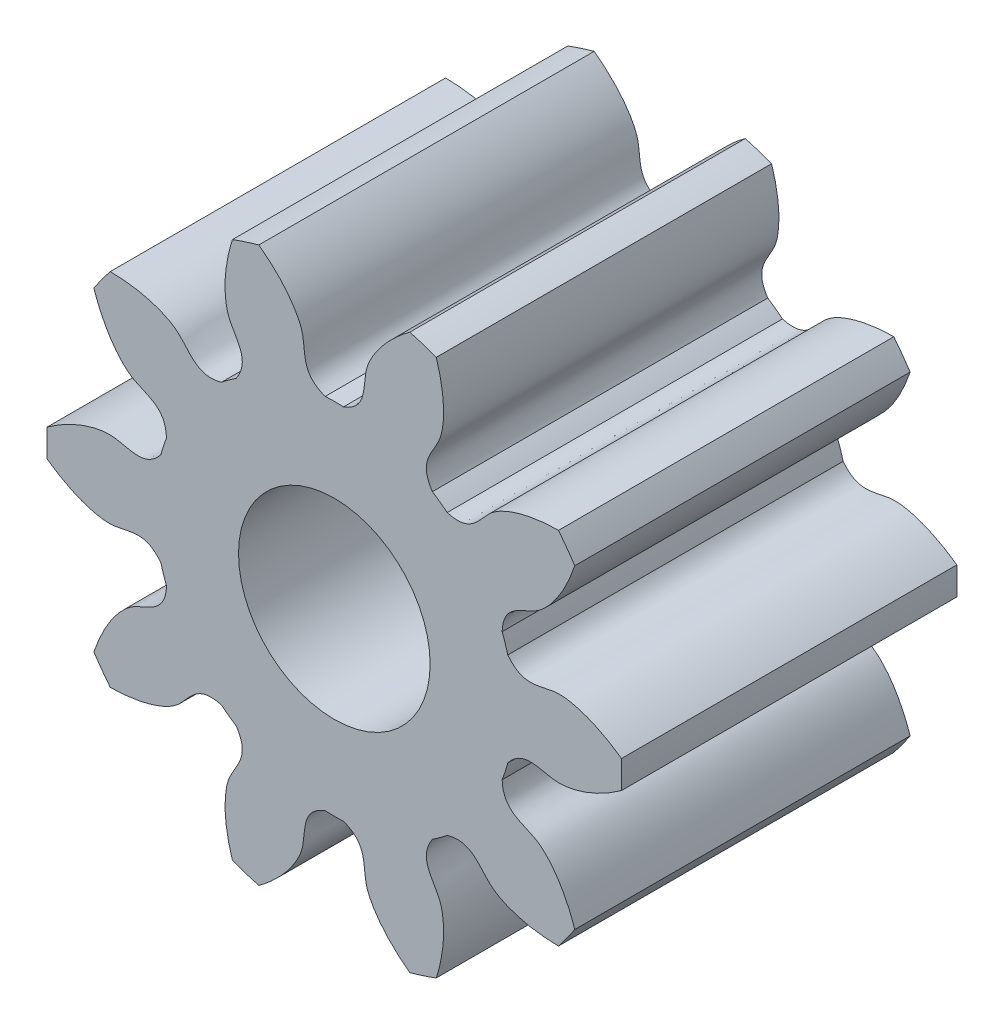
from build123d import *

# Parameters (mm, degrees)
SKETCH_1_R               = 3
EXTRUDE_1_DEPTH          = 3.5
CUT_EXTRUDE_1_DEPTH      = 6.5
PATTERN_CIRCULAR_1_COUNT = 10
SKETCH_4_R               = 1
CUT_EXTRUDE_2_DEPTH      = 6.443239799


with BuildPart() as part:
    # 草图1 → 凸台-拉伸1 (new body)
    with BuildSketch(Plane.XY):
        Circle(SKETCH_1_R)
    extrude(amount=EXTRUDE_1_DEPTH)

    # 草图2 → 切除-拉伸1 (cut, through all)
    with BuildSketch(Plane.XY):
        with BuildLine():
            ThreePointArc((0.095229133, 1.872580148), (0, 1.875), (-0.095229133, 1.872580148))
            add(Edge.make_bspline(
                [(-0.095229133, 1.872580148), (-0.362715165, 1.970284093), (-0.286920777, 2.185294723), (-0.344330803, 2.362336277), (-0.347251515, 2.37077245), (-0.350665635, 2.380030264), (-0.35460634, 2.390093167), (-0.359107284, 2.400943399), (-0.364201322, 2.412562246), (-0.369920867, 2.424929978), (-0.376297744, 2.438025881), (-0.383363205, 2.451828275), (-0.391147884, 2.466314521), (-0.399681784, 2.481461042), (-0.408994243, 2.497243338), (-0.419113912, 2.513636003), (-0.430068732, 2.530612743), (-0.441885908, 2.548146397), (-0.454591887, 2.566208951), (-0.468212335, 2.58477156), (-0.482772111, 2.603804571), (-0.498295251, 2.623277538), (-0.514804941, 2.64315925), (-0.532323498, 2.663417745), (-0.550872351, 2.68402034), (-0.570472019, 2.704933651), (-0.591142092, 2.726123613), (-0.612901212, 2.747555509), (-0.635767055, 2.769193992), (-0.659756316, 2.79100311), (-0.684884687, 2.812946332), (-0.711166843, 2.834986573), (-0.73861643, 2.857086218), (-0.767246042, 2.879207155), (-0.797067213, 2.901310796), (-0.828090401, 2.923358104), (-0.860324974, 2.945309627), (-0.8937792, 2.967125519), (-0.928460232, 2.988765572), (-0.964374099, 3.010189244), (-1.001525696, 3.031355689), (-1.039918773, 3.052223783), (-1.079555927, 3.072752157), (-1.120438592, 3.092899225), (-1.162567035, 3.112623216), (-1.205940346, 3.131882201), (-1.250556433, 3.150634125), (-1.296412017, 3.168836838), (-1.343502628, 3.186448125), (-1.3918226, 3.203425737), (-1.441365068, 3.219727424), (-1.492121969, 3.235310961), (-1.544084033, 3.250134185), (-1.597240793, 3.264155023), (-1.651580574, 3.277331523), (-1.707090504, 3.289621887), (-1.763756505, 3.300984501), (-1.821563307, 3.311377967), (-1.880494441, 3.320761135), (-1.940532246, 3.329093134), (-2.022655253, 3.338820511), (-2.084917451, 3.344293469), (-2.126793313, 3.34714445)],
                knots=[0, 0, 0, 0, 0.201720712, 0.204696754, 0.208022917, 0.211699204, 0.215725612, 0.220102144, 0.224828797, 0.229905574, 0.235332472, 0.241109493, 0.247236637, 0.253713903, 0.260541292, 0.267718803, 0.275246437, 0.283124193, 0.291352071, 0.299930073, 0.308858196, 0.318136442, 0.327764811, 0.337743302, 0.348071916, 0.358750652, 0.36977951, 0.381158491, 0.392887595, 0.404966821, 0.41739617, 0.430175641, 0.443305234, 0.45678495, 0.470614789, 0.48479475, 0.499324833, 0.514205039, 0.529435368, 0.545015819, 0.560946392, 0.577227088, 0.593857907, 0.610838848, 0.628169911, 0.645851097, 0.663882406, 0.682263837, 0.70099539, 0.720077066, 0.739508864, 0.759290785, 0.779422829, 0.799904995, 0.820737283, 0.841919694, 0.863452227, 0.885334883, 0.907567662, 0.930150562, 0.953083586, 1, 1, 1, 1], degree=3))
            ThreePointArc((-2.126793313, 3.34714445), (0, 3.965680996), (2.126793313, 3.34714445))
            add(Edge.make_bspline(
                [(0.095229133, 1.872580148), (0.362715165, 1.970284093), (0.286920777, 2.185294723), (0.344330803, 2.362336277), (0.347251515, 2.37077245), (0.350665635, 2.380030264), (0.35460634, 2.390093167), (0.359107284, 2.400943399), (0.364201322, 2.412562246), (0.369920867, 2.424929978), (0.376297744, 2.438025881), (0.383363205, 2.451828275), (0.391147884, 2.466314521), (0.399681784, 2.481461042), (0.408994243, 2.497243338), (0.419113912, 2.513636003), (0.430068732, 2.530612743), (0.441885908, 2.548146397), (0.454591887, 2.566208951), (0.468212335, 2.58477156), (0.482772111, 2.603804571), (0.498295251, 2.623277538), (0.514804941, 2.64315925), (0.532323498, 2.663417745), (0.550872351, 2.68402034), (0.570472019, 2.704933651), (0.591142092, 2.726123613), (0.612901212, 2.747555509), (0.635767055, 2.769193992), (0.659756316, 2.79100311), (0.684884687, 2.812946332), (0.711166843, 2.834986573), (0.73861643, 2.857086218), (0.767246042, 2.879207155), (0.797067213, 2.901310796), (0.828090401, 2.923358104), (0.860324974, 2.945309627), (0.8937792, 2.967125519), (0.928460232, 2.988765572), (0.964374099, 3.010189244), (1.001525696, 3.031355689), (1.039918773, 3.052223783), (1.079555927, 3.072752157), (1.120438592, 3.092899225), (1.162567035, 3.112623216), (1.205940346, 3.131882201), (1.250556433, 3.150634125), (1.296412017, 3.168836838), (1.343502628, 3.186448125), (1.3918226, 3.203425737), (1.441365068, 3.219727424), (1.492121969, 3.235310961), (1.544084033, 3.250134185), (1.597240793, 3.264155023), (1.651580574, 3.277331523), (1.707090504, 3.289621887), (1.763756505, 3.300984501), (1.821563307, 3.311377967), (1.880494441, 3.320761135), (1.940532246, 3.329093134), (2.022655253, 3.338820511), (2.084917451, 3.344293469), (2.126793313, 3.34714445)],
                knots=[0, 0, 0, 0, 0.201720712, 0.204696754, 0.208022917, 0.211699204, 0.215725612, 0.220102144, 0.224828797, 0.229905574, 0.235332472, 0.241109493, 0.247236637, 0.253713903, 0.260541292, 0.267718803, 0.275246437, 0.283124193, 0.291352071, 0.299930073, 0.308858196, 0.318136442, 0.327764811, 0.337743302, 0.348071916, 0.358750652, 0.36977951, 0.381158491, 0.392887595, 0.404966821, 0.41739617, 0.430175641, 0.443305234, 0.45678495, 0.470614789, 0.48479475, 0.499324833, 0.514205039, 0.529435368, 0.545015819, 0.560946392, 0.577227088, 0.593857907, 0.610838848, 0.628169911, 0.645851097, 0.663882406, 0.682263837, 0.70099539, 0.720077066, 0.739508864, 0.759290785, 0.779422829, 0.799904995, 0.820737283, 0.841919694, 0.863452227, 0.885334883, 0.907567662, 0.930150562, 0.953083586, 1, 1, 1, 1], degree=3))
        make_face()
    cut_extrude_1 = extrude(amount=CUT_EXTRUDE_1_DEPTH, mode=Mode.SUBTRACT)

    # 阵列(圆周)1: 切除-拉伸1 ×10 about axis
    pattern_circular_1_axis = Axis((0, 0, 3.5), (0, 0, -1))
    for i in range(1, PATTERN_CIRCULAR_1_COUNT):
        add(cut_extrude_1.rotate(pattern_circular_1_axis, i * 360 / PATTERN_CIRCULAR_1_COUNT), mode=Mode.SUBTRACT)

    # 草图4 → 切除-拉伸2 (cut, through all)
    with BuildSketch(Plane.XY):
        Circle(SKETCH_4_R)
    extrude(amount=CUT_EXTRUDE_2_DEPTH, mode=Mode.SUBTRACT)


solid = part.part
